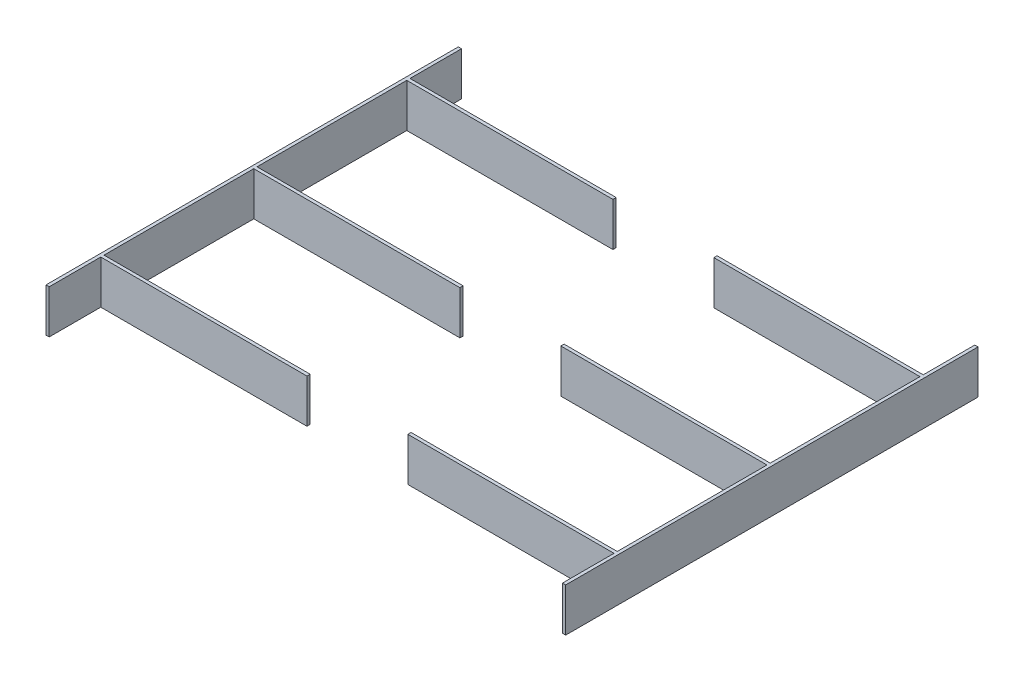
from build123d import *

# Parameters (mm, degrees)
BOSS_EXTRUDE1_DEPTH   = 257.175
BOSS_EXTRUDE1_2_DEPTH = 257.175


with BuildPart() as part:
    # Sketch1 → Boss-Extrude1 (new body)
    with BuildSketch(Plane(origin=(0, 0, 0), x_dir=(1, 0, 0), z_dir=(0, 1, 0))):
        Polygon((-1536.7, 1219.2), (-1517.65, 1219.2), (-1517.65, 914.4), (-298.45, 914.4), (-298.45, 895.35), (-1517.65, 895.35), (-1517.65, 9.525), (-298.45, 9.525), (-298.45, -9.525), (-1517.65, -9.525), (-1517.65, -895.35), (-298.45, -895.35), (-298.45, -914.4), (-1517.65, -914.4), (-1517.65, -1219.2), (-1536.7, -1219.2), align=None)
    extrude(amount=BOSS_EXTRUDE1_DEPTH)


with BuildPart() as body_2:
    # Sketch1 → Boss-Extrude1 2 (new body)
    with BuildSketch(Plane(origin=(0, 0, 0), x_dir=(1, 0, 0), z_dir=(0, 1, 0))):
        Polygon((298.45, -895.35), (298.45, -914.4), (1517.65, -914.4), (1517.65, -1219.2), (1536.7, -1219.2), (1536.7, 1219.2), (1517.65, 1219.2), (1517.65, 914.4), (298.45, 914.4), (298.45, 895.35), (1517.65, 895.35), (1517.65, 9.525), (298.45, 9.525), (298.45, -9.525), (1517.65, -9.525), (1517.65, -895.35), align=None)
    extrude(amount=BOSS_EXTRUDE1_2_DEPTH)


solid = Compound([part.part, body_2.part])
